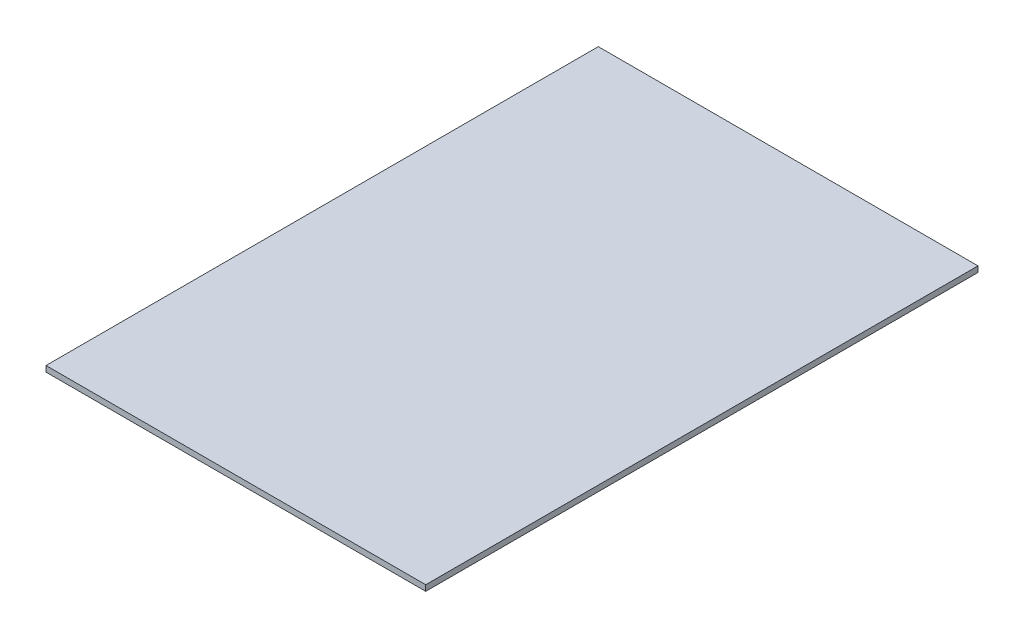
from build123d import *

# Parameters (mm, degrees)
SKETCH1_W           = 838.2
SKETCH1_H           = 1219.2
BOSS_EXTRUDE1_DEPTH = 12.7


with BuildPart() as part:
    # Sketch1 → Boss-Extrude1 (new body)
    with BuildSketch(Plane(origin=(0, 0, 0), x_dir=(1, 0, 0), z_dir=(0, 1, 0))):
        Rectangle(SKETCH1_W, SKETCH1_H)
    extrude(amount=BOSS_EXTRUDE1_DEPTH)


solid = part.part
